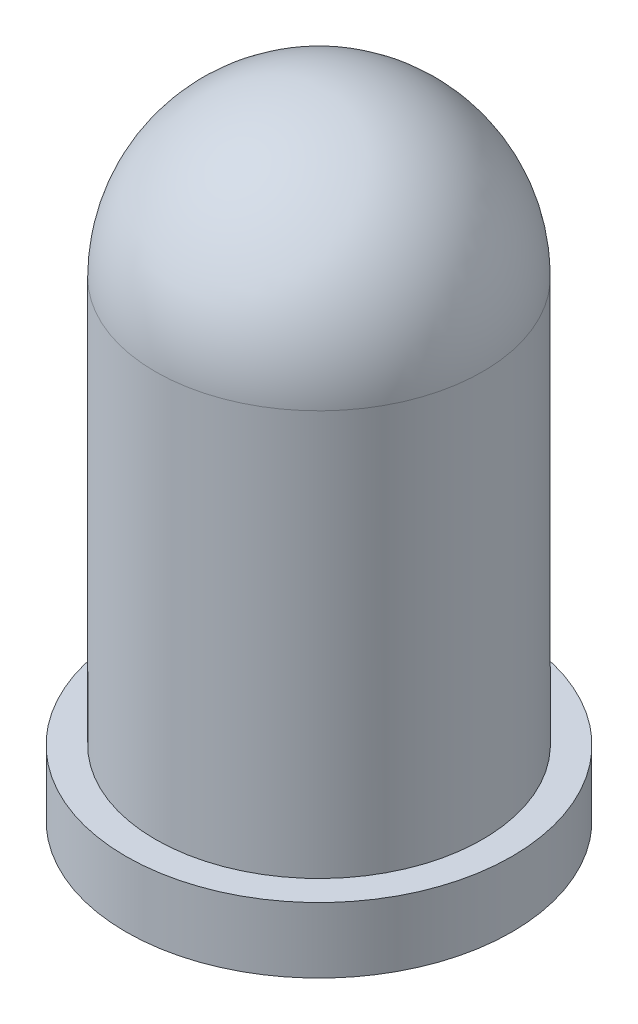
from build123d import *

# Parameters (mm, degrees)
SKETCH2_R   = 2.9499941
BASE_DEPTH  = 1.00000054
SKETCH4_R   = 1.27
DIODE_DEPTH = 5.08


with BuildPart() as part:
    # Sketch1 → Shell (revolve)
    with BuildSketch(Plane.XY, mode=Mode.PRIVATE) as shell_sk:
        with BuildLine():
            Line((-2.499995, 0), (-2.499995, 6.1900054))
            ThreePointArc((-2.499995, 6.1900054), (-1.767763417, 7.957768817), (0, 8.6900004))
            Line((0, 8.6900004), (0, 8.4360004))
            ThreePointArc((0, 8.4360004), (-1.588158295, 7.778163695), (-2.245995, 6.1900054))
            Line((-2.245995, 6.1900054), (-2.245995, 0))
            Line((-2.245995, 0), (-2.499995, 0))
        make_face()
    revolve(shell_sk.sketch.rotate(Axis((0, 9.12450042, 0), (0, -1, 0)), 270), axis=Axis((0, 9.12450042, 0), (0, -1, 0)))

    # Sketch2 → Base (add)
    with BuildSketch(Plane(origin=(0, 0, 0), x_dir=(1, 0, 0), z_dir=(0, 1, 0))):
        with Locations(Location((0, 0, 0), (0, 0, 270))):
            Circle(SKETCH2_R)
    extrude(amount=-BASE_DEPTH)

    # Sketch4 → Diode (add)
    with BuildSketch(Plane(origin=(0, 0, 0), x_dir=(1, 0, 0), z_dir=(0, 1, 0))):
        with Locations(Location((0, 0, 0), (0, 0, 270))):
            Circle(SKETCH4_R)
    extrude(amount=DIODE_DEPTH)


solid = part.part
